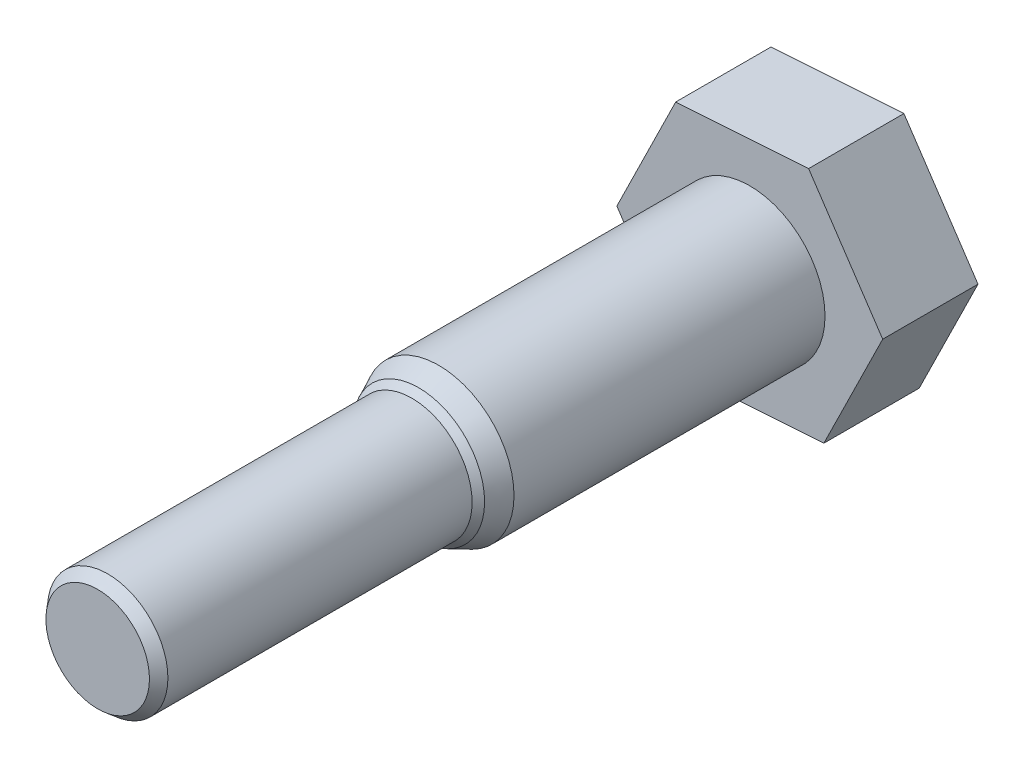
from build123d import *

# Parameters (mm, degrees)
SKETCH_1_R      = 15
EXTRUDE_1_DEPTH = 1
EXTRUDE_2_DEPTH = 19
SKETCH_9_R      = 15
EXTRUDE_3_DEPTH = 62
SKETCH_11_R     = 15
EXTRUDE_6_DEPTH = 4
EXTRUDE_6_TAPER = 25
SKETCH_12_R     = 12
EXTRUDE_7_DEPTH = 62
SKETCH_13_R     = 13.134769367
EXTRUDE_8_DEPTH = 2
EXTRUDE_8_TAPER = 40
SKETCH_15_R     = 12
EXTRUDE_9_DEPTH = 2
EXTRUDE_9_TAPER = 40


with BuildPart() as part:
    # 草图1 → 拉伸1 (new body)
    with BuildSketch(Plane.XY):
        Circle(SKETCH_1_R)
    extrude(amount=EXTRUDE_1_DEPTH)

    # 草图2 → 拉伸2 (add)
    with BuildSketch(Plane.XY):
        Polygon((14.770690633, -22.071702054), (26.5, 1.755942292), (11.729309367, 23.827644346), (-14.770690633, 22.071702054), (-26.5, -1.755942292), (-11.729309367, -23.827644346), align=None)
    extrude(amount=EXTRUDE_2_DEPTH)

    # 草图9 → 拉伸3 (add)
    with BuildSketch(Plane.XY.offset(19)):
        Circle(SKETCH_9_R)
    extrude(amount=EXTRUDE_3_DEPTH)

    # 草图11 → 拉伸6 (add)
    with BuildSketch(Plane.XY.offset(81)):
        Circle(SKETCH_11_R)
    extrude(amount=EXTRUDE_6_DEPTH, taper=EXTRUDE_6_TAPER)

    # 草图12 → 拉伸7 (add)
    with BuildSketch(Plane.XY.offset(85)):
        Circle(SKETCH_12_R)
    extrude(amount=EXTRUDE_7_DEPTH)

    # 草图13 → 拉伸8 (add)
    with BuildSketch(Plane.XY.offset(85)):
        Circle(SKETCH_13_R)
    extrude(amount=EXTRUDE_8_DEPTH, taper=EXTRUDE_8_TAPER)

    # 草图15 → 拉伸9 (add)
    with BuildSketch(Plane.XY.offset(147)):
        Circle(SKETCH_15_R)
    extrude(amount=EXTRUDE_9_DEPTH, taper=EXTRUDE_9_TAPER)


solid = part.part
